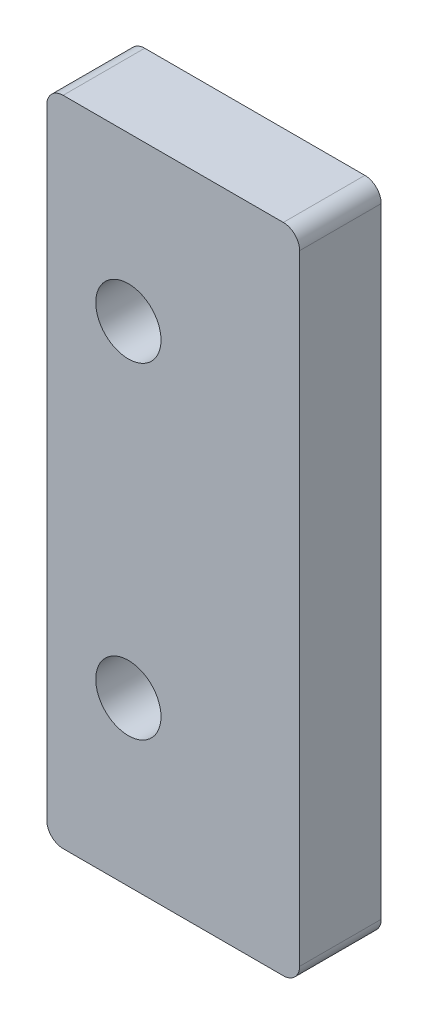
from build123d import *

# Parameters (mm, degrees)
SKETCH1_W           = 15.5
SKETCH1_H           = 40
SKETCH1_R           = 2
BOSS_EXTRUDE1_DEPTH = 5
FILLET1_R           = 1


with BuildPart() as part:
    # Sketch1 → Boss-Extrude1 (new body)
    with BuildSketch(Plane.XY):
        with Locations((7.75, 20)):
            Rectangle(SKETCH1_W, SKETCH1_H)
        with Locations((5, 10)):
            Circle(SKETCH1_R, mode=Mode.SUBTRACT)
        with Locations((5, 30)):
            Circle(SKETCH1_R, mode=Mode.SUBTRACT)
    extrude(amount=BOSS_EXTRUDE1_DEPTH)

    # Fillet1
    fillet1_edges = [part.edges().sort_by_distance(p)[0] for p in [
        (0, 40, 2.5),
        (15.5, 40, 2.5),
        (15.5, 0, 2.5),
        (0, 0, 2.5),
    ]]
    fillet(fillet1_edges, radius=FILLET1_R)


solid = part.part
